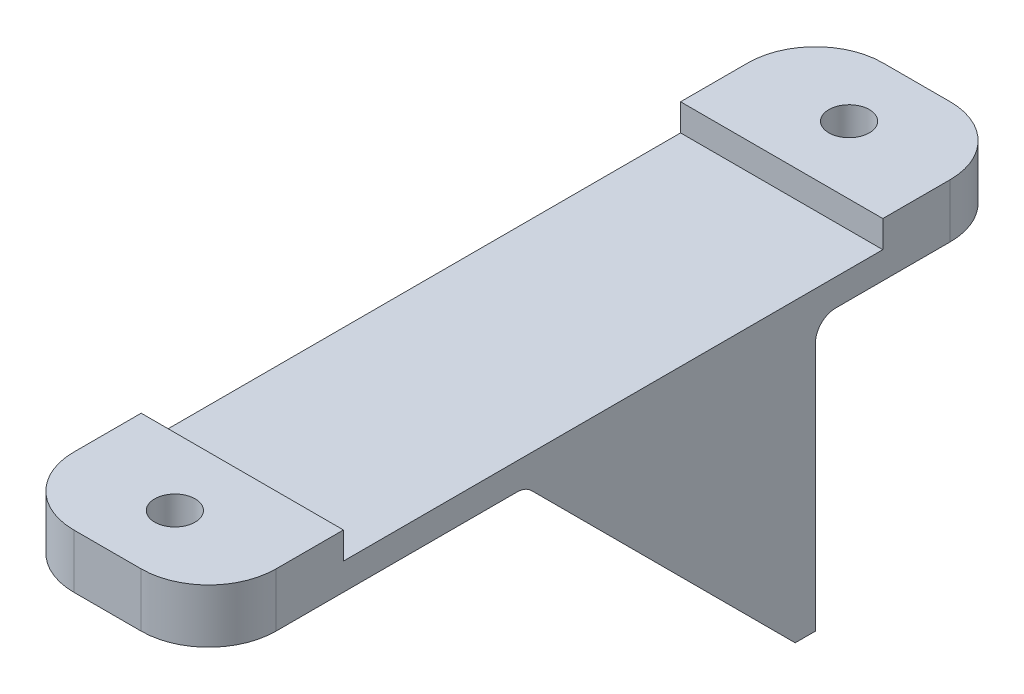
from build123d import *

# Parameters (mm, degrees)
SKETCH1_W           = 30
SKETCH1_H           = 120
BOSS_EXTRUDE1_DEPTH = 8
SKETCH2_W           = 30
SKETCH2_H           = 80
CUT_EXTRUDE1_DEPTH  = 4
SKETCH3_W           = 30
SKETCH3_H           = 3
BOSS_EXTRUDE2_DEPTH = 40
SKETCH4_R           = 8.75
CUT_EXTRUDE2_DEPTH  = 40
BOSS_EXTRUDE3_DEPTH = 2.5
BOSS_EXTRUDE4_DEPTH = 2.5
SKETCH7_R           = 3
CUT_EXTRUDE3_DEPTH  = 131
FILLET1_R           = 10
FILLET2_R           = 3
FILLET3_R           = 3


with BuildPart() as part:
    # Sketch1 → Boss-Extrude1 (new body)
    with BuildSketch(Plane(origin=(0, 0, 0), x_dir=(1, 0, 0), z_dir=(0, 1, 0))):
        with Locations((15, 60)):
            Rectangle(SKETCH1_W, SKETCH1_H)
    extrude(amount=BOSS_EXTRUDE1_DEPTH)

    # Sketch2 → Cut-Extrude1 (cut)
    with BuildSketch(Plane(origin=(0, 8, 0), x_dir=(1, 0, 0), z_dir=(0, 1, 0))):
        with Locations((15, 60)):
            Rectangle(SKETCH2_W, SKETCH2_H)
    extrude(amount=-CUT_EXTRUDE1_DEPTH, mode=Mode.SUBTRACT)

    # Sketch3 → Boss-Extrude2 (add)
    with BuildSketch(Plane.XZ):
        with Locations((15, -88.5)):
            Rectangle(SKETCH3_W, SKETCH3_H)
    extrude(amount=BOSS_EXTRUDE2_DEPTH)

    # Sketch4 → Cut-Extrude2 (cut)
    with BuildSketch(Plane.XY.offset(-87)):
        with Locations((15, -20)):
            Circle(SKETCH4_R)
    extrude(amount=-CUT_EXTRUDE2_DEPTH, mode=Mode.SUBTRACT)

    # Sketch5 → Boss-Extrude3 (add)
    with BuildSketch(Plane(origin=(30, 0, 0), x_dir=(0, 0, -1), z_dir=(1, 0, 0))):
        Polygon((87, -40), (47, 0), (87, 0), align=None)
    extrude(amount=-BOSS_EXTRUDE3_DEPTH)

    # Sketch6 → Boss-Extrude4 (add)
    with BuildSketch(Plane.ZY):
        Polygon((-47, 0), (-87, -40), (-87, 0), align=None)
    extrude(amount=-BOSS_EXTRUDE4_DEPTH)

    # Sketch7 → Cut-Extrude3 (cut, through all)
    with BuildSketch(Plane(origin=(0, 0, 0), x_dir=(-1, 0, 0), z_dir=(0, -1, 0))):
        with Locations(Location((-15, 10, 0), (0, 0, 90))):
            Circle(SKETCH7_R)
        with Locations(Location((-15, 110, 0), (0, 0, 90))):
            Circle(SKETCH7_R)
    extrude(amount=-CUT_EXTRUDE3_DEPTH, mode=Mode.SUBTRACT)

    # Fillet1
    fillet1_edges = [part.edges().sort_by_distance(p)[0] for p in [
        (0, 4, -120),
        (30, 4, -120),
        (30, 4, 0),
        (0, 4, 0),
    ]]
    fillet(fillet1_edges, radius=FILLET1_R)

    # Fillet2
    fillet2_edges = [part.edges().sort_by_distance(p)[0] for p in [
        (15, 0, -90),
    ]]
    fillet(fillet2_edges, radius=FILLET2_R)

    # Fillet3
    fillet3_edges = [part.edges().sort_by_distance(p)[0] for p in [
        (28.75, 0, -47),
        (1.25, 0, -47),
    ]]
    fillet(fillet3_edges, radius=FILLET3_R)


solid = part.part
